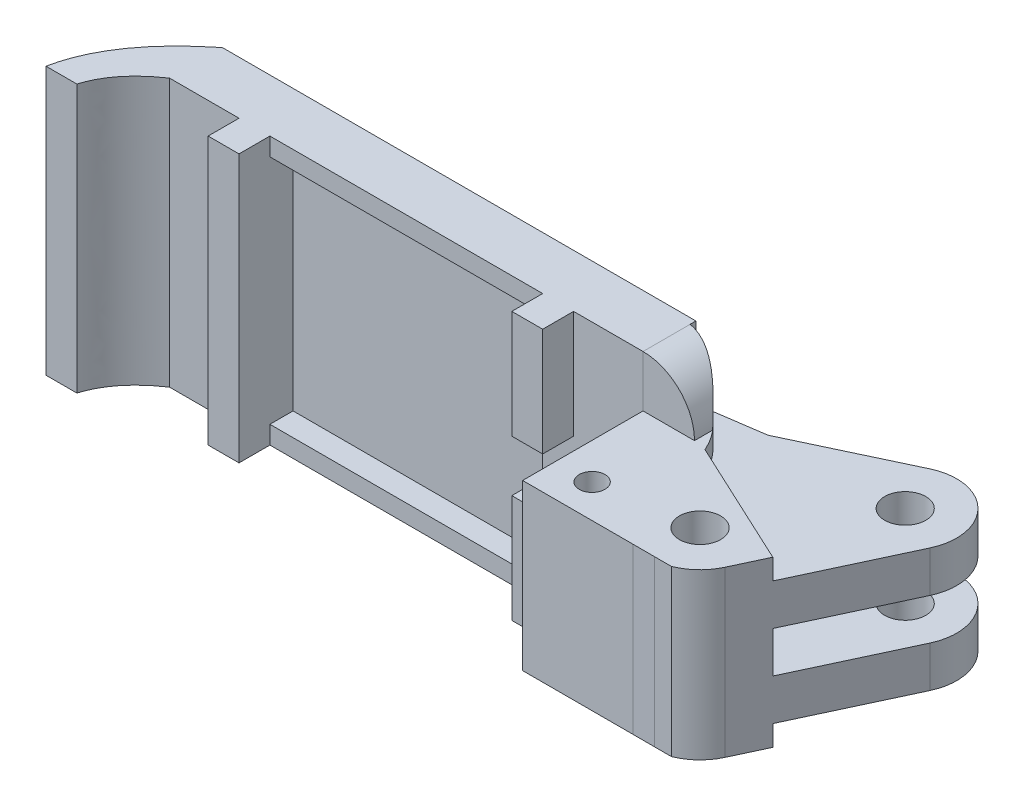
from build123d import *

# Parameters (mm, degrees)
BOSS_EXTRUDE1_DEPTH      = 8
BOSS_EXTRUDE1_DEPTH_BACK = 8
SKETCH2_R                = 2
CUT_EXTRUDE1_DEPTH       = 2
CUT_EXTRUDE2_START       = -2
CUT_EXTRUDE2_DEPTH       = 2
BOSS_EXTRUDE4_DEPTH      = 16
CUT_EXTRUDE4_DEPTH       = 2
CUT_EXTRUDE4_DEPTH_BACK  = 2
BOSS_EXTRUDE6_DEPTH      = 13
BOSS_EXTRUDE6_DEPTH_BACK = 13
SKETCH12_W               = 46
SKETCH12_H               = 5.136814738
SKETCH13_R               = 1.25
CUT_EXTRUDE5_DEPTH       = 16
BOSS_EXTRUDE7_DEPTH      = 26
SKETCH15_W               = 3
SKETCH15_H               = 26
BOSS_EXTRUDE8_DEPTH      = 3
SKETCH20_W               = 2.5
SKETCH20_H               = 4
CUT_EXTRUDE8_DEPTH       = 57.520887153
BOSS_EXTRUDE9_DEPTH      = 5.14
CUT_EXTRUDE9_START       = -5.14
CUT_EXTRUDE9_DEPTH       = 5.14
BOSS_EXTRUDE10_DEPTH     = 5.14
CUT_EXTRUDE10_DEPTH      = 5.14
SKETCH25_W               = 26.5
SKETCH25_H               = 22.5
CUT_EXTRUDE11_DEPTH      = 2.25
SKETCH26_W               = 3
SKETCH26_H               = 5
CUT_EXTRUDE12_DEPTH      = 3


with BuildPart() as part:
    # Sketch2 → Boss-Extrude1 (new, two sides: drawn at the far end of the back side and taken through both)
    with BuildSketch(Plane(origin=(0, 0, 0), x_dir=(1, 0, 0), z_dir=(0, 1, 0)).offset(-BOSS_EXTRUDE1_DEPTH_BACK)):
        with BuildLine():
            Line((-8.523572923, 1.405956139), (-14.862846849, -12.188660667))
            ThreePointArc((-14.862846849, -12.188660667), (-15.958655574, -13.708165939), (-17.536798633, -14.717699254))
            Line((-17.536798633, -14.717699254), (-19.186952062, -14.717699254))
            Line((-19.186952062, -14.717699254), (-21.263787389, -14.712954143))
            Line((-21.263787389, -14.712954143), (-31.98936925, -14.712954143))
            ThreePointArc((-31.98936925, -14.712954143), (-25.026485616, -6.579447275), (-31.98936925, 1.554059594))
            Line((-31.98936925, 1.554059594), (-31.98936925, 2.123860595))
            Line((-31.98936925, 2.123860595), (-25.889500724, 3.009865365))
            Line((-25.889500724, 3.009865365), (-15.1825186, 8.043883417))
            ThreePointArc((-15.1825186, 8.043883417), (-9.525170989, 7.060165556), (-8.523572923, 1.405956139))
        make_face()
        with Locations(Location((-19.394385785, -10.075569358, 0), (0, 0, 270))):
            Circle(SKETCH2_R, mode=Mode.SUBTRACT)
        with Locations(Location((-13.055111858, 3.519047448, 0), (0, 0, 270))):
            Circle(SKETCH2_R, mode=Mode.SUBTRACT)
    extrude(amount=BOSS_EXTRUDE1_DEPTH + BOSS_EXTRUDE1_DEPTH_BACK)

    # Sketch3 → Cut-Extrude1 (cut)
    with BuildSketch(Plane.XZ.offset(8)):
        with BuildLine():
            Line((-13.383682933, 9.016583412), (-36.019194906, -1.538529167))
            Line((-36.019194906, -1.538529167), (-25.889500724, -3.009865365))
            Line((-25.889500724, -3.009865365), (-15.1825186, -8.043883417))
            ThreePointArc((-15.1825186, -8.043883417), (-9.525170989, -7.060165556), (-8.523572923, -1.405956139))
            Line((-8.523572923, -1.405956139), (-13.383682933, 9.016583412))
        make_face()
    extrude(amount=-CUT_EXTRUDE1_DEPTH, mode=Mode.SUBTRACT)

    # Sketch4 → Cut-Extrude2 (cut)
    with BuildSketch(Plane(origin=(0, 8, 0), x_dir=(1, 0, 0), z_dir=(0, 1, 0)).offset(CUT_EXTRUDE2_START)):
        with BuildLine():
            Line((-13.383682933, -9.016583412), (-36.019194906, 1.538529167))
            Line((-36.019194906, 1.538529167), (-25.889500724, 3.009865365))
            Line((-25.889500724, 3.009865365), (-15.1825186, 8.043883417))
            ThreePointArc((-15.1825186, 8.043883417), (-9.525170989, 7.060165556), (-8.523572923, 1.405956139))
            Line((-8.523572923, 1.405956139), (-13.383682933, -9.016583412))
        make_face()
    extrude(amount=CUT_EXTRUDE2_DEPTH, mode=Mode.SUBTRACT)

    # Sketch7 → Boss-Extrude4 (add)
    with BuildSketch(Plane.XZ.offset(8)):
        with BuildLine():
            Line((-31.98936925, -1.554059594), (-31.98936925, 14.712954143))
            ThreePointArc((-31.98936925, 14.712954143), (-26.036622944, 10.530440134), (-25.724576966, 3.261930016))
            ThreePointArc((-25.724576966, 3.261930016), (-28.241329009, 0.053085809), (-31.98936925, -1.554059594))
        make_face()
    extrude(amount=-BOSS_EXTRUDE4_DEPTH)

    # Sketch10 → Cut-Extrude4 (cut, two sides: drawn at the far end of the back side and taken through both)
    with BuildSketch(Plane(origin=(0, 0, 0), x_dir=(1, 0, 0), z_dir=(0, 1, 0)).offset(-CUT_EXTRUDE4_DEPTH_BACK)):
        with BuildLine():
            Line((-25.889500724, 3.009865365), (-15.1825186, 8.043883417))
            ThreePointArc((-15.1825186, 8.043883417), (-9.525170989, 7.060165556), (-8.523572923, 1.405956139))
            Line((-8.523572923, 1.405956139), (-13.383682933, -9.016583412))
            Line((-13.383682933, -9.016583412), (-25.724576966, -3.261930016))
            ThreePointArc((-25.724576966, -3.261930016), (-28.241329009, -0.053085809), (-31.98936925, 1.554059594))
            Line((-31.98936925, 1.554059594), (-31.98936925, 2.123860595))
            Line((-31.98936925, 2.123860595), (-25.889500724, 3.009865365))
        make_face()
    extrude(amount=CUT_EXTRUDE4_DEPTH + CUT_EXTRUDE4_DEPTH_BACK, mode=Mode.SUBTRACT)

    # Sketch12 → Boss-Extrude6 (add, two sides: drawn at the far end of the back side and taken through both)
    with BuildSketch(Plane(origin=(0, 0, 0), x_dir=(1, 0, 0), z_dir=(0, 1, 0)).offset(-BOSS_EXTRUDE6_DEPTH_BACK)):
        with Locations((-54.98936925, -0.444546774)):
            Rectangle(SKETCH12_W, SKETCH12_H)
    extrude(amount=BOSS_EXTRUDE6_DEPTH + BOSS_EXTRUDE6_DEPTH_BACK)

    # Sketch13 → Cut-Extrude5 (cut)
    with BuildSketch(Plane.XZ.offset(8)):
        with Locations(Location((-28.48936925, 11.462954143, 0), (0, 0, 270))):
            Circle(SKETCH13_R)
    extrude(amount=-CUT_EXTRUDE5_DEPTH, mode=Mode.SUBTRACT)

    # Sketch14 → Boss-Extrude7 (add)
    with BuildSketch(Plane.XZ.offset(13)):
        with BuildLine():
            Line((-81.98936925, 8.012954143), (-84.98936925, 8.012954143))
            add(Edge.make_bspline(
                [(-77.98936925, -2.123860595), (-83.929409171, 2.617289227), (-84.98936925, 8.012954143)],
                knots=[0, 0, 0, 0.697154263, 0.697154263, 0.697154263], degree=2))
            Line((-77.98936925, -2.123860595), (-77.98936925, 3.012954143))
            add(Edge.make_bspline(
                [(-77.98936925, 3.012954143), (-81.112416602, 5.119010403), (-81.98936925, 8.012954143)],
                knots=[0, 0, 0, 0.561523676, 0.561523676, 0.561523676], degree=2))
        make_face()
    extrude(amount=-BOSS_EXTRUDE7_DEPTH)

    # Sketch15 → Boss-Extrude8 (add)
    with BuildSketch(Plane.XY.offset(3.012954143)):
        with Locations((-40.23936925, 0)):
            Rectangle(SKETCH15_W, SKETCH15_H)
        with Locations((-69.73936925, 0)):
            Rectangle(SKETCH15_W, SKETCH15_H)
    extrude(amount=BOSS_EXTRUDE8_DEPTH)

    # Sketch20 → Cut-Extrude8 (cut, through all)
    with BuildSketch(Plane.ZY.offset(31.98936925)):
        with Locations((3.021305608, 0)):
            Rectangle(SKETCH20_W, SKETCH20_H)
    extrude(amount=-CUT_EXTRUDE8_DEPTH, mode=Mode.SUBTRACT)

    # Sketch21 → Boss-Extrude9 (add)
    with BuildSketch(Plane(origin=(0, 0, -2.123860595), x_dir=(-1, 0, 0), z_dir=(0, 0, -1))):
        with BuildLine():
            Line((26.98936925, 8), (31.98936925, 8))
            Line((31.98936925, 8), (31.98936925, 13))
            ThreePointArc((31.98936925, 13), (28.453835344, 11.535533906), (26.98936925, 8))
        make_face()
    extrude(amount=-BOSS_EXTRUDE9_DEPTH)

    # Sketch22 → Cut-Extrude9 (cut)
    with BuildSketch(Plane(origin=(0, 13, 0), x_dir=(1, 0, 0), z_dir=(0, 1, 0)).offset(CUT_EXTRUDE9_START)):
        with BuildLine():
            Line((-31.98936925, 2.123860595), (-31.98936925, 1.554059594))
            ThreePointArc((-31.98936925, 1.554059594), (-29.238037233, 0.603941382), (-26.98936925, -1.244313143))
            Line((-26.98936925, -1.244313143), (-26.98936925, 2.123860595))
            Line((-26.98936925, 2.123860595), (-31.98936925, 2.123860595))
        make_face()
    extrude(amount=CUT_EXTRUDE9_DEPTH, mode=Mode.SUBTRACT)

    # Sketch23 → Boss-Extrude10 (add)
    with BuildSketch(Plane(origin=(0, 0, -2.123860595), x_dir=(-1, 0, 0), z_dir=(0, 0, -1))):
        with BuildLine():
            Line((31.98936925, -8), (31.98936925, -13))
            ThreePointArc((31.98936925, -13), (28.453835344, -11.535533906), (26.98936925, -8))
            Line((26.98936925, -8), (31.98936925, -8))
        make_face()
    extrude(amount=-BOSS_EXTRUDE10_DEPTH)

    # Sketch24 → Cut-Extrude10 (cut)
    with BuildSketch(Plane.XZ.offset(13)):
        with BuildLine():
            Line((-31.98936925, -1.554059594), (-31.98936925, -2.123860595))
            Line((-31.98936925, -2.123860595), (-25.837669131, -2.123860595))
            Line((-25.837669131, -2.123860595), (-25.837669131, 3.016139405))
            ThreePointArc((-25.837669131, 3.016139405), (-26.35642668, 2.093115722), (-26.98936925, 1.244313143))
            ThreePointArc((-26.98936925, 1.244313143), (-29.238037233, -0.603941382), (-31.98936925, -1.554059594))
        make_face()
    extrude(amount=-CUT_EXTRUDE10_DEPTH, mode=Mode.SUBTRACT)

    # Sketch25 → Cut-Extrude11 (cut)
    with BuildSketch(Plane.XY.offset(3.012954143)):
        with Locations((-54.98936925, 0)):
            Rectangle(SKETCH25_W, SKETCH25_H)
    extrude(amount=-CUT_EXTRUDE11_DEPTH, mode=Mode.SUBTRACT)

    # Sketch26 → Cut-Extrude12 (cut)
    with BuildSketch(Plane.XY.offset(6.012954143)):
        with Locations((-40.23936925, 0)):
            Rectangle(SKETCH26_W, SKETCH26_H)
    extrude(amount=-CUT_EXTRUDE12_DEPTH, mode=Mode.SUBTRACT)


solid = part.part
